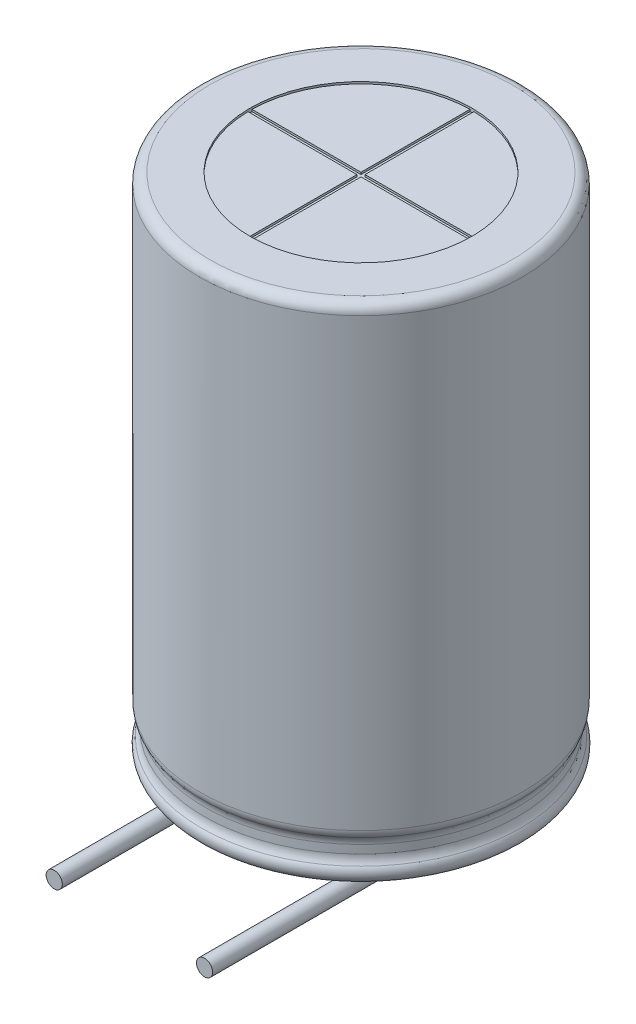
from build123d import *

# Parameters (mm, degrees)
SKETCH2_R             = 5.5
CUT_EXTRUDE1_DEPTH    = 0.1
CUT_EXTRUDE2_DEPTH    = 0.1
CORTAR_EXTRUIR1_START = -0.25
CROQUIS4_R            = 5.5
CORTAR_EXTRUIR1_DEPTH = 0.25
FILLET1_R             = 0.5
CROQUIS8_R            = 0.4
CROQUIS7_R            = 0.4


with BuildPart() as part:
    # Sketch1 → Revolve1 (revolve)
    with BuildSketch(Plane.XY):
        with BuildLine():
            Line((8, 25), (0, 25))
            Line((0, 25), (0, 0))
            Line((0, 0), (8, 0))
            ThreePointArc((8, 0), (8.092932458, 0.406232629), (7.928060317, 0.788957816))
            ThreePointArc((7.928060317, 0.788957816), (7.803725589, 0.995469347), (7.760416667, 1.232599004))
            Line((7.760416667, 1.232599004), (7.760416667, 1.642400996))
            ThreePointArc((7.760416667, 1.642400996), (7.791064683, 1.842850794), (7.880208333, 2.024984899))
            ThreePointArc((7.880208333, 2.024984899), (7.969351983, 2.207119004), (8, 2.407568802))
            Line((8, 2.407568802), (8, 25))
        make_face()
    revolve(axis=Axis((0, 25, 0), (0, -1, 0)))

    # Sketch2 → Cut-Extrude1 (cut)
    with BuildSketch(Plane(origin=(0, 25, 0), x_dir=(-1, 0, 0), z_dir=(0, 1, 0))):
        with Locations(Location((0, 0, 0), (0, 0, 270))):
            Circle(SKETCH2_R)
    extrude(amount=-CUT_EXTRUDE1_DEPTH, mode=Mode.SUBTRACT)

    # Sketch3 → Cut-Extrude2 (cut)
    with BuildSketch(Plane(origin=(0, 24.9, 0), x_dir=(-1, 0, 0), z_dir=(0, 1, 0))):
        with BuildLine():
            Line((-5.499090834, -0.1), (-0.1, -0.1))
            Line((-0.1, -0.1), (-0.1, -5.499090834))
            ThreePointArc((-0.1, -5.499090834), (-0.050002066, -5.499772704), (0, -5.5))
            ThreePointArc((0, -5.5), (0.050002066, -5.499772704), (0.1, -5.499090834))
            Line((0.1, -5.499090834), (0.1, -0.1))
            Line((0.1, -0.1), (5.499090834, -0.1))
            ThreePointArc((5.499090834, -0.1), (5.499772704, -0.050002066), (5.5, 0))
            ThreePointArc((5.5, 0), (5.499772704, 0.050002066), (5.499090834, 0.1))
            Line((5.499090834, 0.1), (0.1, 0.1))
            Line((0.1, 0.1), (0.1, 5.499090834))
            ThreePointArc((0.1, 5.499090834), (0.050002066, 5.499772704), (0, 5.5))
            ThreePointArc((0, 5.5), (-0.050002066, 5.499772704), (-0.1, 5.499090834))
            Line((-0.1, 5.499090834), (-0.1, 0.1))
            Line((-0.1, 0.1), (-5.499090834, 0.1))
            ThreePointArc((-5.499090834, 0.1), (-5.499772704, 0.050002066), (-5.5, 0))
            ThreePointArc((-5.5, 0), (-5.499772704, -0.050002066), (-5.499090834, -0.1))
        make_face()
    extrude(amount=-CUT_EXTRUDE2_DEPTH, mode=Mode.SUBTRACT)

    # Croquis4 → Cortar-Extruir1 (cut)
    with BuildSketch(Plane.XZ.offset(CORTAR_EXTRUIR1_START)):
        with Locations(Location((0, 0, 0), (0, 0, 88.95820115))):
            Circle(CROQUIS4_R)
    extrude(amount=CORTAR_EXTRUIR1_DEPTH, mode=Mode.SUBTRACT)

    # Fillet1
    fillet1_edges = [part.edges().sort_by_distance(p)[0] for p in [
        (-8, 25, 0),
        (-8, 0, 0),
    ]]
    fillet(fillet1_edges, radius=FILLET1_R)

    # Barrer6: sweep along a path in Croquis2
    with BuildLine(Plane(origin=(3.75, 0, 0), x_dir=(0, 0, -1), z_dir=(1, 0, 0))) as barrer6_path:
        Line((0, 0.25), (0, 0))
        ThreePointArc((0, 0), (-0.439339828, -1.060660172), (-1.5, -1.5))
        Line((-1.5, -1.5), (-11.5, -1.5))
    # Croquis8 → Barrer6 (sweep)
    with BuildSketch(Plane.XZ.offset(-0.25)):
        with Locations((3.75, 0)):
            Circle(CROQUIS8_R)
    sweep(path=barrer6_path.line)

    # Barrer7: sweep along a path in Croquis6
    with BuildLine(Plane(origin=(-3.75, 0, 0), x_dir=(0, 0, -1), z_dir=(1, 0, 0))) as barrer7_path:
        Line((0.052276978, 0.25), (0.052276978, 0))
        ThreePointArc((0.052276978, 0), (-0.387062851, -1.060660172), (-1.447723022, -1.5))
        Line((-1.447723022, -1.5), (-11.447723022, -1.5))
    # Croquis7 → Barrer7 (sweep)
    with BuildSketch(Plane.XZ.offset(-0.25)):
        with Locations((-3.75, -0.052276978)):
            Circle(CROQUIS7_R)
    sweep(path=barrer7_path.line)


solid = part.part
